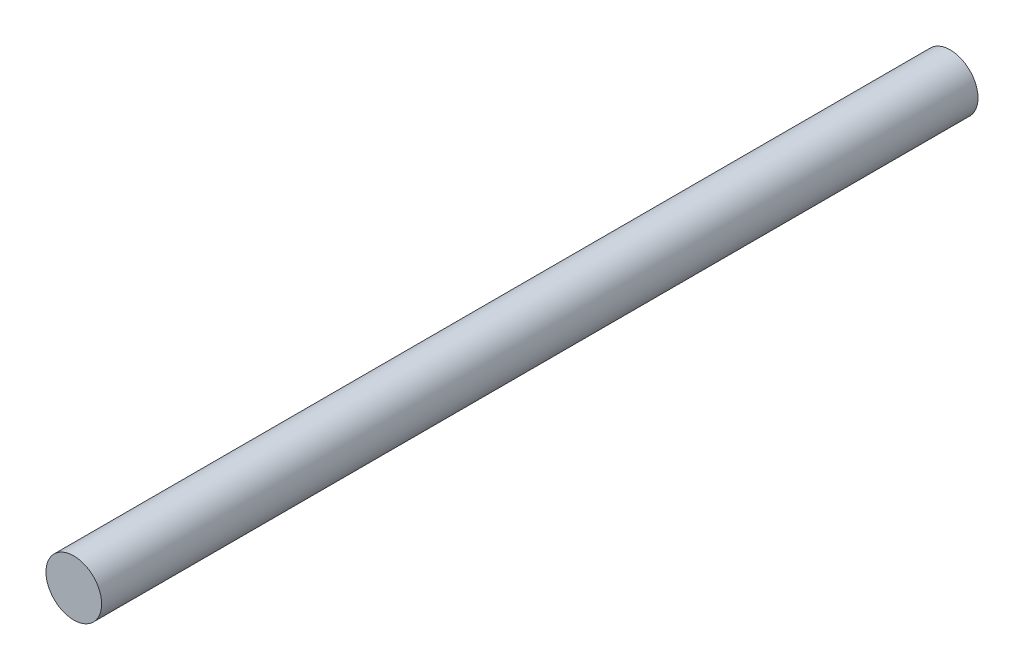
from build123d import *

# Parameters (mm, degrees)
SKETCH1_R           = 2
BOSS_EXTRUDE2_DEPTH = 63


with BuildPart() as part:
    # Sketch1 → Boss-Extrude2 (new body)
    with BuildSketch(Plane.XY):
        Circle(SKETCH1_R)
    extrude(amount=BOSS_EXTRUDE2_DEPTH)


solid = part.part
